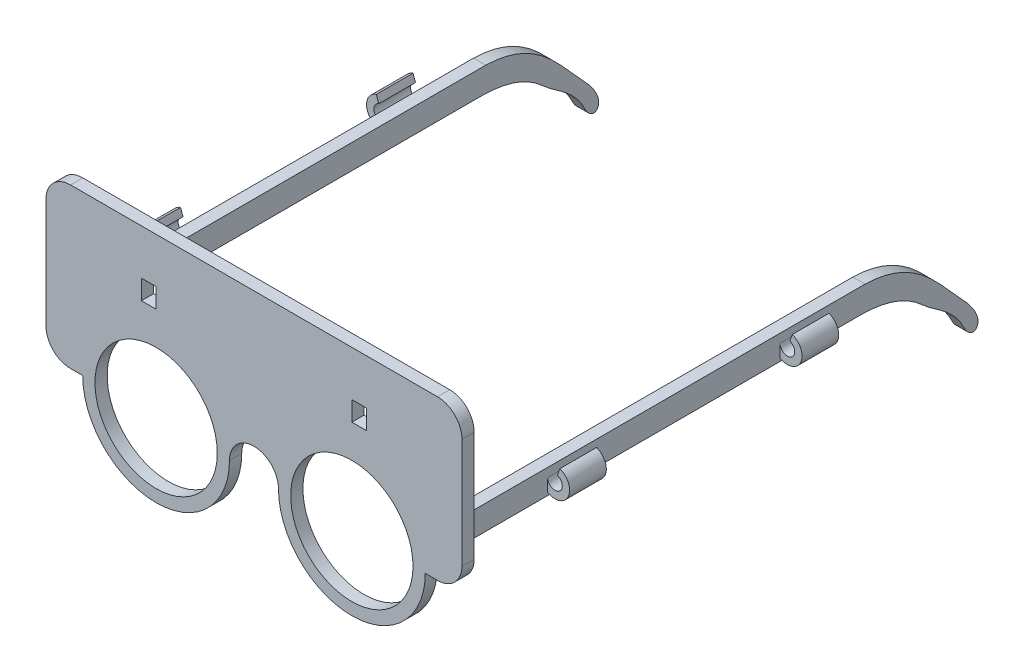
from build123d import *

# Parameters (mm, degrees)
SKETCH1_R                                = 25
SKETCH1_W                                = 5
SKETCH1_H                                = 10
SKETCH1_W_2                              = 6
SKETCH1_H_2                              = 8
BOSS_EXTRUDE1_DEPTH                      = 5
BOSS_EXTRUDE2_DEPTH                      = 2.5
BOSS_EXTRUDE3_DEPTH                      = 15
MIRROR2_AT_THE_SECOND_PLANE_COPY_1_DEPTH = 15


with BuildPart() as part:
    # Sketch1 → Boss-Extrude1 (new body)
    with BuildSketch(Plane.XY):
        with BuildLine():
            Line((-85, 10), (-85, 55))
            ThreePointArc((-85, 55), (-82.071067812, 62.071067812), (-75, 65))
            Line((-75, 65), (75, 65))
            ThreePointArc((75, 65), (82.071067812, 62.071067812), (85, 55))
            Line((85, 55), (85, 10))
            ThreePointArc((85, 10), (82.071067812, 2.928932188), (75, 0))
            Line((75, 0), (70, 0))
            ThreePointArc((70, 0), (40, -30), (10, 0))
            ThreePointArc((10, 0), (0, 10), (-10, 0))
            ThreePointArc((-10, 0), (-40, -30), (-70, 0))
            Line((-70, 0), (-75, 0))
            ThreePointArc((-75, 0), (-82.071067812, 2.928932188), (-85, 10))
        make_face()
        with Locations((-40, 0)):
            Circle(SKETCH1_R, mode=Mode.SUBTRACT)
        with Locations((40, 0)):
            Circle(SKETCH1_R, mode=Mode.SUBTRACT)
        with Locations((77.5, 17.5)):
            Rectangle(SKETCH1_W, SKETCH1_H, mode=Mode.SUBTRACT)
        with Locations((-77.5, 17.5)):
            Rectangle(SKETCH1_W, SKETCH1_H, mode=Mode.SUBTRACT)
        with Locations((-43, 42.5)):
            Rectangle(SKETCH1_W_2, SKETCH1_H_2, mode=Mode.SUBTRACT)
        with Locations((43, 42.5)):
            Rectangle(SKETCH1_W_2, SKETCH1_H_2, mode=Mode.SUBTRACT)
    extrude(amount=BOSS_EXTRUDE1_DEPTH)

    # Sketch3 → Boss-Extrude2 (add, symmetric)
    with BuildSketch(Plane(origin=(77.5, 0, 0), x_dir=(0, 0, -1), z_dir=(1, 0, 0))):
        with BuildLine():
            Line((162.715433116, 22.5), (-5, 22.5))
            Line((-5, 22.5), (-5, 12.5))
            Line((-5, 12.5), (162.715433116, 12.5))
            add(Edge.make_bspline(
                [(164.743567387, 22.5), (176.888156271, 22.22365164), (190.063206982, 13.898931456), (201.205108259, 0.348525399), (209.863666742, -8.112907318), (211.119317355, -13.823756845), (209.926264366, -17.209453352), (206.496989633, -16.049999116), (201.730005175, -5.214706728), (193.119767997, -1.000904025), (186.359494631, 5.188589695), (177.192853258, 12.5), (162.715433116, 12.5)],
                knots=[0.008893046, 0.008893046, 0.008893046, 0.008893046, 0.17143556, 0.266664333, 0.355542364, 0.377182358, 0.385125973, 0.429439348, 0.469195356, 0.742930043, 0.799432191, 1, 1, 1, 1], degree=3))
            Line((164.743567387, 22.5), (162.715433116, 22.5))
        make_face()
    boss_extrude2 = extrude(amount=BOSS_EXTRUDE2_DEPTH, both=True)

    # Mirror1: Boss-Extrude2 across plane
    add(boss_extrude2.mirror(Plane(origin=(0, 0, 0), x_dir=(0, 0, 1), z_dir=(1, 0, 0))))

    # Sketch6 → Boss-Extrude3 (add)
    with BuildSketch(Plane.XY.offset(-50)):
        with BuildLine():
            Line((80, 18.892369738), (80, 13.696217315))
            ThreePointArc((80, 13.696217315), (88.449489743, 16.381779858), (85, 24.549223988))
            Line((85, 24.549223988), (84, 21.720796863))
            ThreePointArc((84, 21.720796863), (85.828427125, 17.892369738), (82, 16.063942613))
            ThreePointArc((82, 16.063942613), (80.550510257, 17.16031893), (80, 18.892369738))
        make_face()
    boss_extrude3 = extrude(amount=BOSS_EXTRUDE3_DEPTH)

    # Mirror2: Boss-Extrude3 across plane
    add(boss_extrude3.mirror(Plane.XY.offset(-90)))

    # Mirror2 at the second plane: Boss-Extrude3 across plane
    add(boss_extrude3.mirror(Plane(origin=(0, 0, 0), x_dir=(0, 0, 1), z_dir=(1, 0, 0))))

    # Mirror2 at the second plane copy 1 sketc → Mirror2 at the second plane copy 1 (add)
    with BuildSketch(Plane(origin=(0, 0, -130), x_dir=(-1, 0, 0), z_dir=(0, 0, -1))):
        with BuildLine():
            Line((80, 18.892369738), (80, 13.696217315))
            ThreePointArc((80, 13.696217315), (88.449489743, 16.381779858), (85, 24.549223988))
            Line((85, 24.549223988), (84, 21.720796863))
            ThreePointArc((84, 21.720796863), (85.828427125, 17.892369738), (82, 16.063942613))
            ThreePointArc((82, 16.063942613), (80.550510257, 17.16031893), (80, 18.892369738))
        make_face()
    extrude(amount=MIRROR2_AT_THE_SECOND_PLANE_COPY_1_DEPTH)


solid = part.part
